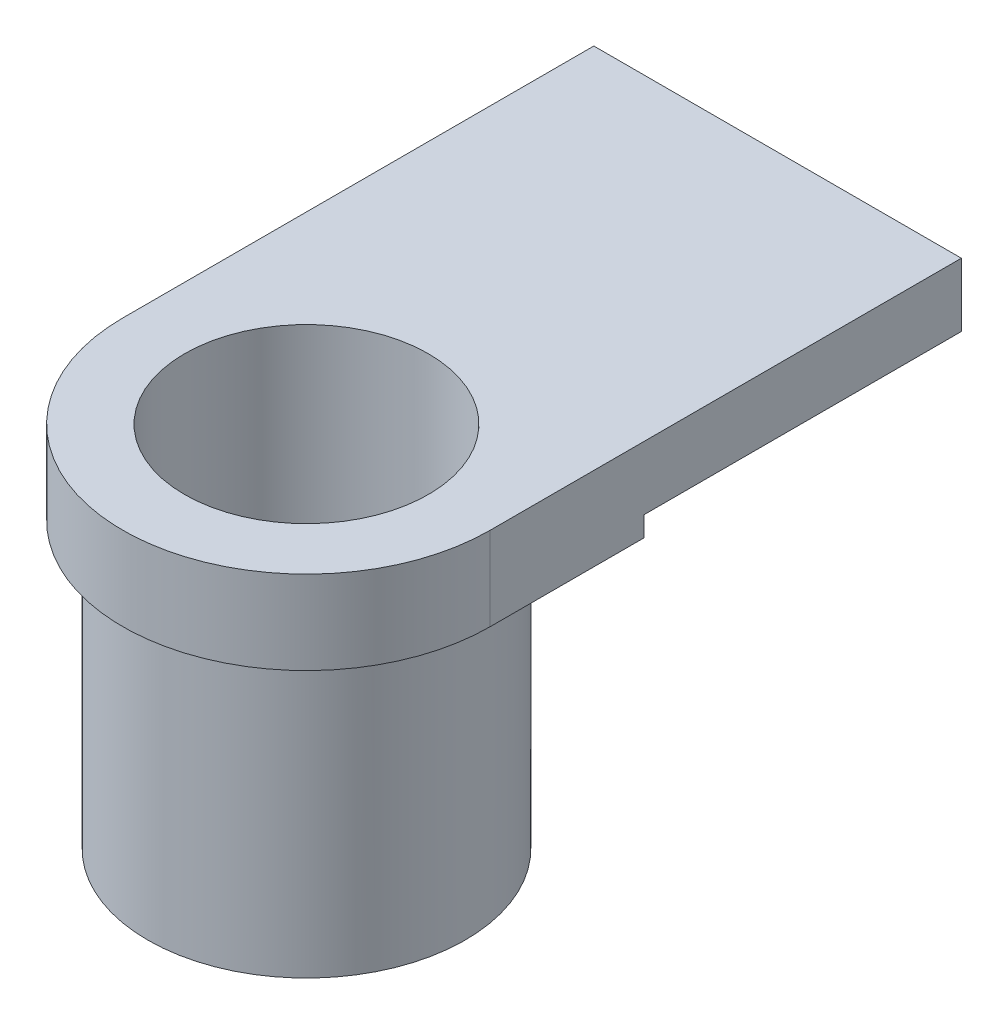
from build123d import *
from build123d.topology import SkipClean

# Parameters (mm, degrees)
SKETCH1_R           = 4.75
BOSS_EXTRUDE1_DEPTH = 2
SKETCH2_R           = 4.75
SKETCH2_R_2         = 3.65
BOSS_EXTRUDE2_DEPTH = 6.5
SKETCH3_R           = 3.65
BOSS_EXTRUDE3_DEPTH = 2.5
CUT_EXTRUDE1_START  = -1.9
SKETCH5_W           = 11
SKETCH5_H           = 9.490844779
CUT_EXTRUDE1_DEPTH  = 1


with BuildPart() as part:
    # Sketch1 → Boss-Extrude1 (new body)
    with BuildSketch(Plane(origin=(0, 0, 0), x_dir=(1, 0, 0), z_dir=(0, 1, 0))):
        Circle(SKETCH1_R)
        with BuildLine():
            Line((-1.028169014, 2.171577767), (-1.028169014, -2.171577767))
            Line((-1.028169014, -2.171577767), (-2.9337263, -2.171577767))
            ThreePointArc((-2.9337263, -2.171577767), (-3.65, 0), (-2.9337263, 2.171577767))
            Line((-2.9337263, 2.171577767), (-1.028169014, 2.171577767))
        make_face(mode=Mode.SUBTRACT)
        with BuildLine():
            Line((1.028169014, 2.171577767), (2.9337263, 2.171577767))
            ThreePointArc((2.9337263, 2.171577767), (3.65, 0), (2.9337263, -2.171577767))
            Line((2.9337263, -2.171577767), (1.028169014, -2.171577767))
            Line((1.028169014, -2.171577767), (1.028169014, 2.171577767))
        make_face(mode=Mode.SUBTRACT)
    extrude(amount=BOSS_EXTRUDE1_DEPTH)

    # Sketch2 → Boss-Extrude2 (add)
    with SkipClean():  # the faces are left unmerged after this step: merging them gives an invalid solid
        with BuildSketch(Plane(origin=(0, 2, 0), x_dir=(1, 0, 0), z_dir=(0, 1, 0))):
            Circle(SKETCH2_R)
            Circle(SKETCH2_R_2, mode=Mode.SUBTRACT)
        extrude(amount=BOSS_EXTRUDE2_DEPTH)

    # Sketch3 → Boss-Extrude3 (add)
    with SkipClean():  # the faces are left unmerged after this step: merging them gives an invalid solid
        with BuildSketch(Plane(origin=(0, 8.5, 0), x_dir=(1, 0, 0), z_dir=(0, 1, 0))):
            with BuildLine():
                ThreePointArc((-5.5, 0), (0, -5.5), (5.5, 0))
                Line((5.5, 0), (5.5, 14.1))
                Line((5.5, 14.1), (-5.5, 14.1))
                Line((-5.5, 14.1), (-5.5, 0))
            make_face()
            Circle(SKETCH3_R, mode=Mode.SUBTRACT)
        extrude(amount=BOSS_EXTRUDE3_DEPTH)

    # Sketch5 → Cut-Extrude1 (cut)
    with SkipClean():  # the faces are left unmerged after this step: merging them gives an invalid solid
        with BuildSketch(Plane(origin=(0, 11, 0), x_dir=(1, 0, 0), z_dir=(0, 1, 0)).offset(CUT_EXTRUDE1_START)):
            with Locations((0, 9.354577611)):
                Rectangle(SKETCH5_W, SKETCH5_H)
        extrude(amount=-CUT_EXTRUDE1_DEPTH, mode=Mode.SUBTRACT)


solid = part.part
